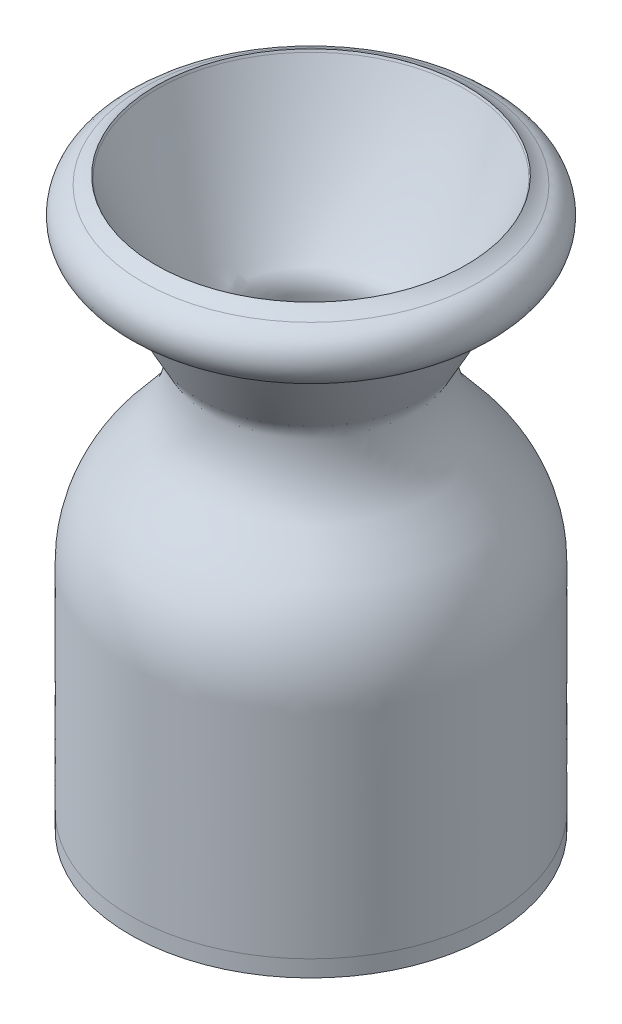
from build123d import *


with BuildPart() as part:
    # Sketch1 → Revolve1 (revolve)
    with BuildSketch(Plane.XY, mode=Mode.PRIVATE) as revolve1_sk:
        with BuildLine():
            Line((53.048476388, 41.598590087), (53.879976, 41.247755591))
            add(Edge.make_bspline(
                [(53.879976, 41.247755591), (53.54713967, 40.418655125), (53.033230018, 39.153702144), (52.352976744, 37.500891631), (51.898842498, 36.406429012), (51.460878956, 35.359594242), (50.980501104, 34.221085563), (50.560774604, 33.235635596), (50.247489444, 32.504931791), (50.139974257, 32.254958246), (50.082331454, 32.121171469)],
                knots=[0, 0, 0, 0, 0.271130684, 0.414352889, 0.54241183, 0.630732992, 0.758725841, 0.917419438, 0.955790527, 1, 1, 1, 1], degree=3))
            add(Edge.make_bspline(
                [(51.01924215, 49.068556666), (51.944628514, 48.678108529), (53.199627802, 48.148586957), (54.831287787, 47.460140811), (55.552535681, 47.155825028), (55.964709733, 46.981916314), (56.013005173, 46.961539155), (56.073981548, 46.935810954), (56.132137164, 46.911276294), (56.198380537, 46.882471913), (56.249016454, 46.859991057), (58.575941812, 45.808548957), (60.649937191, 43.075950367), (60.97528123, 40.02597412), (60.981412847, 39.187103061), (60.758902856, 36.988750035), (59.20497443, 33.88321425), (55.687599608, 31.773422358), (52.735891109, 31.456744673), (50.982467291, 31.799013186), (50.253789409, 32.0543323), (50.082331454, 32.121171469)],
                knots=[0, 0, 0, 0, 0.100575645, 0.136399627, 0.177337021, 0.178964476, 0.18119679, 0.182586002, 0.18559173, 0.187517205, 0.189819368, 0.191139078, 0.443253756, 0.469169777, 0.498817185, 0.526979639, 0.690413453, 0.821553175, 0.921762184, 0.980583128, 0.999014047, 0.999014047, 0.999014047, 0.999014047], degree=3))
            add(Edge.make_bspline(
                [(51.01924215, 49.068556666), (51.010659799, 49.048369962), (50.9997378, 49.022685351), (50.984871471, 48.987733869), (50.97604411, 48.966983261), (45.122255465, 35.208423563), (38.10051081, 20.537976966), (28.307442634, 7.571095489), (27.48482367, 6.527778145), (27.322322068, 6.324295316), (27.27374288, 6.26257177), (27.222429416, 6.206440047), (27.168508971, 6.152046264), (27.133023661, 6.115455668), (26.819289025, 5.790410517), (26.4233238, 5.310823059), (26.000230951, 4.67808898), (25.723318033, 4.206110849), (25.454476545, 3.674289009), (24.969736695, 2.510974739), (24.722065286, 1.363545117), (24.666552366, 0.392202693), (24.661502281, 0.215451196), (24.659998635, 0.126149502), (24.659377242, 0.073671207), (24.659170753, 0.049431392), (24.659053026, 0.027730381), (24.658980315, 0.006736482), (24.659003253, -0.015804059), (24.659031785, -0.041846915), (24.659075075, -0.06250623), (24.660496541, -0.528930626), (24.700592744, -2.438003406), (25.135382484, -6.733624643), (27.177099013, -14.360489649), (30.854711407, -20.625100536), (34.110055472, -24.271994311), (34.755733689, -24.94486992), (34.950769935, -25.14347401), (35.023247768, -25.216945042), (35.108575333, -25.303111357), (35.169269766, -25.363829673), (35.232502494, -25.427060802), (35.27095605, -25.465514751), (35.31616128, -25.510719856), (35.364595375, -25.559153983), (36.296203144, -26.490761605), (37.318410129, -27.512968784), (39.98105761, -30.17561609), (41.820914277, -32.015477938), (43.5769697, -33.77152777), (43.685935665, -33.880494679), (43.733847859, -33.928405512), (43.767679825, -33.962241906), (43.799037325, -33.993589582), (43.820753269, -34.015340819), (43.840274732, -34.034897309), (43.857587754, -34.052275603), (43.882762115, -34.077587343), (43.917082066, -34.112187736), (43.955118662, -34.150642689), (44.573361311, -34.77686849), (45.964196629, -36.286809976), (48.788489467, -39.918966592), (52.300852474, -46.222316376), (54.060920114, -52.754110984), (54.497671587, -57.329069237), (54.564367964, -58.7037177), (54.577250817, -59.452923468), (54.580052674, -59.749386702), (54.581201144, -59.924642036), (54.581109127, -60.073234436), (54.581122186, -60.215145849), (54.581119475, -60.326852507), (54.581120464, -60.460065401), (54.581120127, -60.606941171), (54.581120209, -60.753816936), (54.581120136, -61.406835884), (54.581120297, -64.182113341), (54.581119831, -84.508717001), (54.581120219, -107.003869003), (54.581120194, -127.468329682), (54.581120194, -130.433558694), (54.581120194, -130.725735711), (54.581120194, -130.941150947), (54.581120194, -131.060067351), (54.581120194, -131.12269277)],
                knots=[0, 0, 0, 0, 0.00033536, 0.00042671, 0.000580687, 0.00068012, 0.229023422, 0.245551084, 0.249049321, 0.249335797, 0.249532388, 0.250250126, 0.250496415, 0.250703503, 0.251029368, 0.257403436, 0.260168563, 0.262662135, 0.265765204, 0.269270387, 0.281924067, 0.283395501, 0.284147728, 0.284627129, 0.284760999, 0.284950101, 0.284997734, 0.285092782, 0.285271069, 0.285342346, 0.28549094, 0.285586921, 0.292473346, 0.314679912, 0.351417702, 0.412498649, 0.423199009, 0.426158635, 0.426754602, 0.427454707, 0.427736471, 0.428608585, 0.428767253, 0.429103629, 0.429440006, 0.429744648, 0.430150839, 0.449582593, 0.451846113, 0.487720787, 0.489362776, 0.489814287, 0.490076785, 0.490398686, 0.490545827, 0.490754669, 0.490868595, 0.490968285, 0.491129706, 0.491414385, 0.491713366, 0.491956641, 0.504868217, 0.523070839, 0.562199338, 0.614417405, 0.624908775, 0.632456137, 0.635450053, 0.636364496, 0.636988837, 0.638129506, 0.638636249, 0.639158463, 0.639837342, 0.640672885, 0.641403985, 0.642082864, 0.650656618, 0.68383404, 0.952847793, 0.994575574, 0.996706607, 0.998181937, 0.999042546, 1, 1, 1, 1], degree=3))
            Line((54.581120194, -131.12269277), (54.581120194, -132.021860641))
            Line((54.581120194, -132.021860641), (0, -132.021860641))
            Line((0, -132.021860641), (0, -131.122700641))
            Line((0, -131.122700641), (54.129609794, -131.122700641))
            add(Edge.make_bspline(
                [(50.9540256, 50.071993417), (50.873819382, 49.881899853), (50.712013805, 49.499314495), (50.478954039, 48.950886712), (50.250614244, 48.415998626), (50.044150217, 47.934465815), (49.384275912, 46.401688458), (47.387676579, 41.844875202), (44.12092331, 34.821005472), (37.785410755, 22.470169484), (32.220728451, 13.328153286), (27.426253471, 7.182971916), (27.196951124, 6.89230366), (27.103732732, 6.77471332), (27.037151416, 6.690732051), (26.988434471, 6.630017931), (26.931404544, 6.557076461), (26.862586576, 6.484366508), (26.760279055, 6.380117747), (26.639758248, 6.251577701), (26.509499906, 6.106401459), (26.366171392, 5.939771144), (26.232594219, 5.776565202), (26.086092891, 5.588630936), (25.959726509, 5.41780427), (25.137725186, 4.250129447), (24.411771434, 2.5018887), (24.219954065, 0.704718904), (24.208818587, 0.154947108), (24.207873822, 0.079689385), (24.20761838, 0.042888092), (24.207540141, 0.027730375), (24.207481869, 0.010624212), (24.207490258, -0.007254201), (24.207499847, -0.023577774), (24.207521277, -0.041846914), (24.207890257, -0.220270707), (24.212302254, -0.777357826), (24.261195453, -2.321869379), (24.905637625, -9.748221077), (27.774842596, -16.756085977), (31.477710964, -21.774612477), (32.271314333, -22.84282242), (33.227788606, -23.990401408), (34.266138841, -25.0870929), (34.502122611, -25.331205679), (34.630000028, -25.461232296), (34.701994433, -25.534180607), (34.735291707, -25.567840471), (34.764399165, -25.597197956), (34.789288767, -25.622257696), (34.823748962, -25.65687509), (34.856167117, -25.689280822), (34.885922576, -25.719037387), (34.903989341, -25.737103899), (34.926306924, -25.75942154), (35.01229943, -25.845413982), (36.853916595, -27.687031757), (39.614395549, -30.447509272), (42.324482766, -33.157598157), (43.29336958, -34.126484126), (43.35106234, -34.184177123), (43.395091434, -34.228205591), (43.464944078, -34.298060723), (43.551518026, -34.384582449), (43.652705185, -34.486933574), (43.736056274, -34.571567941), (43.829212672, -34.666556101), (44.928483106, -35.798161046), (48.170912554, -39.59453754), (50.848158596, -44.461504706), (53.368459691, -51.633585284), (54.08665386, -55.898300012), (54.127799901, -59.642527886), (54.128886895, -59.789100788), (54.129364499, -59.882713808), (54.129617534, -59.961388903), (54.129608925, -60.025142419), (54.129609911, -60.080774019), (54.129609735, -60.124197142), (54.129609829, -60.190688797), (54.12960938, -61.357562186), (54.129609939, -63.344824297), (54.129609782, -65.686417879), (54.129609884, -78.273030501), (54.12960976, -99.150571478), (54.129609795, -119.943778541), (54.129609794, -129.533368434), (54.129609794, -130.317544838), (54.129609794, -130.796442406), (54.129609794, -131.122700641)],
                knots=[0, 0, 0, 0, 0.003141418, 0.006324725, 0.009072981, 0.011996572, 0.014301976, 0.034481558, 0.087747352, 0.132192235, 0.245910225, 0.249708307, 0.250864578, 0.251547212, 0.25199307, 0.252496328, 0.252732544, 0.253402438, 0.254018238, 0.254957237, 0.256084674, 0.256987848, 0.258303548, 0.259295324, 0.260615863, 0.261538003, 0.281042936, 0.288357701, 0.288990745, 0.289414954, 0.289503651, 0.289551088, 0.289645746, 0.289764107, 0.289823302, 0.289894286, 0.290042271, 0.292539956, 0.298376837, 0.313559996, 0.406150364, 0.406243228, 0.407329969, 0.426164153, 0.428796692, 0.430333464, 0.431333282, 0.431573491, 0.431893991, 0.432054173, 0.432202947, 0.432431763, 0.432797884, 0.43290086, 0.433072487, 0.433186905, 0.433381416, 0.434924127, 0.47284168, 0.492821633, 0.493279314, 0.493704303, 0.49406391, 0.494227367, 0.495208438, 0.4959275, 0.496418748, 0.497017071, 0.497953213, 0.52043931, 0.57290478, 0.581048474, 0.636246968, 0.637342272, 0.638065533, 0.638478681, 0.638767632, 0.639263431, 0.639449381, 0.639614669, 0.639924585, 0.640461772, 0.657381289, 0.670182306, 0.676114485, 0.849022952, 0.988060261, 0.992708385, 0.995032448, 1, 1, 1, 1], degree=3))
            Line((50.9540256, 50.071993417), (51.274020267, 50.830400074))
            ThreePointArc((51.274020267, 50.830400074), (53.330782836, 49.293987657), (55.607885425, 48.108391105))
            add(Edge.make_bspline(
                [(55.607885425, 48.108391105), (56.001495268, 47.93681106), (56.488224293, 47.751219753), (57.054658191, 47.471740394), (57.351237627, 47.31285048), (57.707365671, 47.102501939), (58.163200354, 46.800933535), (58.744928821, 46.35533032), (59.381570925, 45.761960804), (61.390463502, 43.469300884), (62.392058302, 39.420190756), (61.099533388, 35.729244111), (59.797507741, 33.700656892), (57.914344096, 31.97307345), (55.581602035, 30.956069783), (53.557498297, 30.649030641), (52.02880219, 30.687337073), (50.821962122, 30.919722177), (50.071339287, 31.162483701), (49.782863329, 31.272669456), (49.725239197, 31.295372382)],
                knots=[0, 0, 0, 0, 0.045455103, 0.055006744, 0.066818288, 0.081049447, 0.098756644, 0.124620409, 0.158509029, 0.190602583, 0.447388765, 0.540774596, 0.600103552, 0.701064665, 0.806286077, 0.86400467, 0.916615269, 0.967325941, 0.99344653, 1, 1, 1, 1], degree=3))
            add(Edge.make_bspline(
                [(49.725239197, 31.295372382), (49.705341185, 31.249521907), (49.674784061, 31.179151084), (49.623021657, 31.060050858), (46.820558004, 24.617706984), (42.576432795, 15.572731927), (37.760259396, 6.651574106), (35.883003013, 3.338962511), (35.375167352, 2.448709176), (34.818305203, 1.494238074), (34.540902529, 1.00544192), (34.235841049, 0.511180091), (34.120304419, 0.163552259), (34.131169776, -0.156011067), (34.131196538, -0.313707323), (34.133001696, -0.468244283), (34.135377844, -0.657288024), (34.180180878, -2.990567278), (34.495029532, -5.905822173), (35.882306492, -11.933514002), (37.557023231, -15.863128607), (39.621371155, -18.932323409), (39.890760776, -19.320416004), (40.121487065, -19.639147699), (40.344222769, -19.941771055), (40.549887794, -20.206848001), (40.730915449, -20.43467307), (40.885804867, -20.630204734), (41.138038065, -20.947435118), (41.437678498, -21.323206274), (43.08827122, -23.383087139), (44.85797609, -25.537436133), (46.778625668, -27.823999329), (47.322704665, -28.469115517), (47.696396556, -28.909870981), (48.014305607, -29.285005316), (48.37805813, -29.709798051), (48.734183442, -30.129812883), (49.007034325, -30.456861506), (49.246919351, -30.749720433), (49.445714124, -30.99729442), (52.03321767, -34.253789487), (55.276023202, -39.521927136), (57.650798428, -45.937627581), (59.217780551, -51.8010413), (59.756342386, -55.895353706), (59.814447069, -59.269863466), (59.817709648, -59.53917678), (59.82057695, -59.851694464), (59.82028112, -60.168505858), (59.82032476, -60.484426998), (59.820311804, -60.762258761), (59.82031626, -61.125642428), (59.820314474, -61.591107675), (59.820318226, -65.606895711), (59.820308585, -84.536796226), (59.820315606, -106.913767021), (59.820314977, -126.059298687), (59.820314984, -130.323608927), (59.820314984, -130.936295712), (59.820314984, -131.122601331)],
                knots=[0, 0, 0, 0, 0.000866834, 0.001330532, 0.002252193, 0.122709842, 0.174430005, 0.178040226, 0.188745016, 0.192202242, 0.197209635, 0.198478377, 0.202297979, 0.203276183, 0.204017213, 0.205033307, 0.205956322, 0.207296049, 0.245508673, 0.256417435, 0.314633308, 0.317765154, 0.320575839, 0.322825661, 0.324589106, 0.327092283, 0.32864365, 0.32963579, 0.331418402, 0.335672502, 0.337971007, 0.377197099, 0.384020081, 0.389760279, 0.391833071, 0.394041707, 0.398288194, 0.401532155, 0.403591871, 0.405674828, 0.408097504, 0.409098254, 0.47781207, 0.513984878, 0.527411908, 0.583069255, 0.584844973, 0.585947706, 0.587740229, 0.590265146, 0.591442083, 0.593219239, 0.595083562, 0.597744224, 0.601291774, 0.664729129, 0.926044328, 0.989374211, 0.996768913, 1, 1, 1, 1], degree=3))
            Line((59.820314984, -131.122601331), (59.820314984, -136.593860641))
            Line((59.820314984, -136.593860641), (0, -136.593860641))
            Line((0, -136.593860641), (0, -134.053860641))
            Line((0, -134.053860641), (58.917294184, -134.053860641))
            Line((58.917294184, -134.053860641), (58.917294184, -131.122617085))
            add(Edge.make_bspline(
                [(53.048476388, 41.598590087), (52.869642072, 41.153272945), (52.596130272, 40.475587986), (52.173999321, 39.440032993), (51.733912349, 38.366433235), (50.96101107, 36.495197303), (46.719497385, 26.418360975), (41.4080252, 15.096920256), (35.653792496, 4.729659151), (34.319658318, 2.414342037), (33.979730718, 1.829136196), (33.853608345, 1.612880572), (33.737772974, 1.412884782), (33.440826788, 0.92134421), (33.210787065, 0.336427994), (33.229749457, -0.269375502), (33.229925795, -0.522274844), (33.235411605, -0.834355063), (33.243946802, -1.170709486), (33.261288705, -1.676856829), (33.284176247, -2.137817079), (33.315386715, -2.644519148), (33.699853395, -7.968775174), (35.42070766, -14.063282), (38.672934854, -19.149367343), (39.386393382, -20.152814383), (39.675727633, -20.548088343), (39.880391766, -20.805370509), (39.923203196, -20.859521924), (39.935838074, -20.875494791), (39.949257268, -20.892458626), (40.296805509, -21.331739853), (41.660919557, -23.045210069), (44.072216897, -26.002424901), (46.250436046, -28.597895873), (47.406775369, -29.95954913), (47.519598995, -30.09223108), (47.584887961, -30.16904937), (47.639189218, -30.232511106), (47.691644499, -30.293653599), (47.728731238, -30.337066904), (47.774981638, -30.391340666), (48.593974916, -31.355374845), (49.800072168, -32.880875187), (54.74428742, -39.966899977), (58.260405033, -49.035486494), (58.896983356, -57.684297952), (58.915537015, -59.644910178), (58.916337137, -59.748264645), (58.916797868, -59.82289999), (58.917361246, -59.938344858), (58.9172801, -60.083933287), (58.917296152, -60.233637095), (58.917293651, -60.345343745), (58.917294361, -60.457241427), (58.917291501, -62.45475282), (58.917303655, -78.250977174), (58.917292383, -100.039859257), (58.917294225, -120.852410821), (58.917294182, -128.37011832), (58.917294184, -129.908489979), (58.917294184, -130.573747364), (58.917294184, -130.785473997), (58.917294184, -130.971784872), (58.917294184, -131.090676051), (58.917294184, -131.122617085)],
                knots=[0, 0, 0, 0, 0.007828019, 0.011920963, 0.018241829, 0.026755189, 0.044945995, 0.196595457, 0.230349613, 0.238345109, 0.24018583, 0.241388619, 0.242429683, 0.243953047, 0.250790333, 0.252143339, 0.253822234, 0.25491758, 0.257234311, 0.25931086, 0.263178623, 0.264762629, 0.267591405, 0.3502892, 0.363300123, 0.36604407, 0.370372916, 0.371287792, 0.37140668, 0.371498962, 0.371620008, 0.371759511, 0.380636146, 0.407346303, 0.433999173, 0.435906908, 0.436486575, 0.436840214, 0.437551435, 0.437849016, 0.438154338, 0.438482828, 0.439012201, 0.45878887, 0.470157705, 0.580032934, 0.61055357, 0.611464703, 0.612016056, 0.612239572, 0.6126822, 0.613899247, 0.614614444, 0.615124215, 0.615721439, 0.616439752, 0.647708213, 0.873394143, 0.971866466, 0.987208736, 0.996025221, 0.996960842, 0.998060612, 0.999478968, 1, 1, 1, 1], degree=3))
        make_face()
    revolve(revolve1_sk.sketch.rotate(Axis((0, -0.163355665, 0), (0, -1, 0)), 180), axis=Axis((0, -0.163355665, 0), (0, -1, 0)))


solid = part.part
